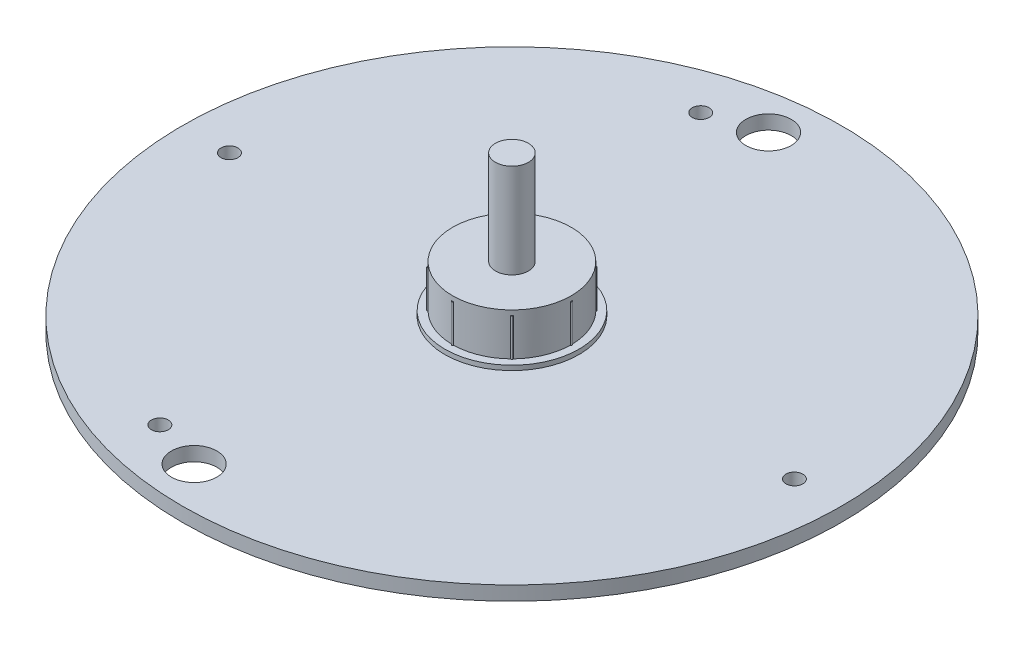
from build123d import *

# Parameters (mm, degrees)
SKETCH1_R                      = 70
BASE_PLATE_DEPTH               = 3
SKETCH2_R                      = 14.25
BEARING_STEPUP_DEPTH           = 1
SKETCH3_R                      = 12.6
BEARING_SITTING_DEPTH          = 9
SKETCH4_R                      = 0.2
BEARING_SITTING_GRID_DEPTH     = 8
SKETCH5_R                      = 1.8
M3_SCREW_CLEARANCE_HOLES_DEPTH = 100.844879688
SKETCH6_R                      = 4.825
HOLES_RESERVED_FOR_RODS_DEPTH  = 100.844879688
SKETCH7_R                      = 3.5
BOSS_EXTRUDE5_DEPTH            = 20


with BuildPart() as part:
    # Sketch1 → base-plate (new body)
    with BuildSketch(Plane(origin=(0, 0, 0), x_dir=(1, 0, 0), z_dir=(0, 1, 0))):
        with Locations(Location((0, 0, 0), (0, 0, 270))):
            Circle(SKETCH1_R)
    extrude(amount=BASE_PLATE_DEPTH)

    # Sketch2 → bearing-stepup (add)
    with BuildSketch(Plane(origin=(0, 3, 0), x_dir=(1, 0, 0), z_dir=(0, 1, 0))):
        with Locations(Location((0, 0, 0), (0, 0, 270))):
            Circle(SKETCH2_R)
    extrude(amount=BEARING_STEPUP_DEPTH)

    # Sketch3 → bearing-sitting (add)
    with BuildSketch(Plane(origin=(0, 4, 0), x_dir=(1, 0, 0), z_dir=(0, 1, 0))):
        with Locations(Location((0, 0, 0), (0, 0, 270))):
            Circle(SKETCH3_R)
    extrude(amount=BEARING_SITTING_DEPTH)

    # Sketch4 → bearing-sitting-grid (add)
    with BuildSketch(Plane(origin=(0, 4, 0), x_dir=(1, 0, 0), z_dir=(0, 1, 0))):
        with Locations((0, 12.6)):
            Circle(SKETCH4_R)
        with Locations((8.909545443, 8.909545443)):
            Circle(SKETCH4_R)
        with Locations((12.6, 0)):
            Circle(SKETCH4_R)
        with Locations((8.909545443, -8.909545443)):
            Circle(SKETCH4_R)
        with Locations((0, -12.6)):
            Circle(SKETCH4_R)
        with Locations((-8.909545443, -8.909545443)):
            Circle(SKETCH4_R)
        with Locations((-12.6, 0)):
            Circle(SKETCH4_R)
        with Locations((-8.909545443, 8.909545443)):
            Circle(SKETCH4_R)
    extrude(amount=BEARING_SITTING_GRID_DEPTH)

    # Sketch5 → m3-screw-clearance-holes (cut, through all)
    with BuildSketch(Plane.XZ):
        with Locations(Location((-17.341907817, 57.439169852, 0), (0, 0, 270))):
            Circle(SKETCH5_R)
        with Locations(Location((-60, 0, 0), (0, 0, 270))):
            Circle(SKETCH5_R)
        with Locations(Location((-17.341907817, -57.439169852, 0), (0, 0, 270))):
            Circle(SKETCH5_R)
        with Locations(Location((60, 0, 0), (0, 0, 270))):
            Circle(SKETCH5_R)
    extrude(amount=-M3_SCREW_CLEARANCE_HOLES_DEPTH, mode=Mode.SUBTRACT)

    # Sketch6 → holes-reserved-for-rods (cut, through all)
    with BuildSketch(Plane.XZ):
        with Locations(Location((-6.5, 61, 0), (0, 0, 270))):
            Circle(SKETCH6_R)
        with Locations(Location((-6.5, -61, 0), (0, 0, 270))):
            Circle(SKETCH6_R)
    extrude(amount=-HOLES_RESERVED_FOR_RODS_DEPTH, mode=Mode.SUBTRACT)

    # Sketch7 → Boss-Extrude5 (add)
    with BuildSketch(Plane(origin=(0, 13, 0), x_dir=(1, 0, 0), z_dir=(0, 1, 0))):
        with Locations(Location((0, 0, 0), (0, 0, 270))):
            Circle(SKETCH7_R)
    extrude(amount=BOSS_EXTRUDE5_DEPTH)


solid = part.part
